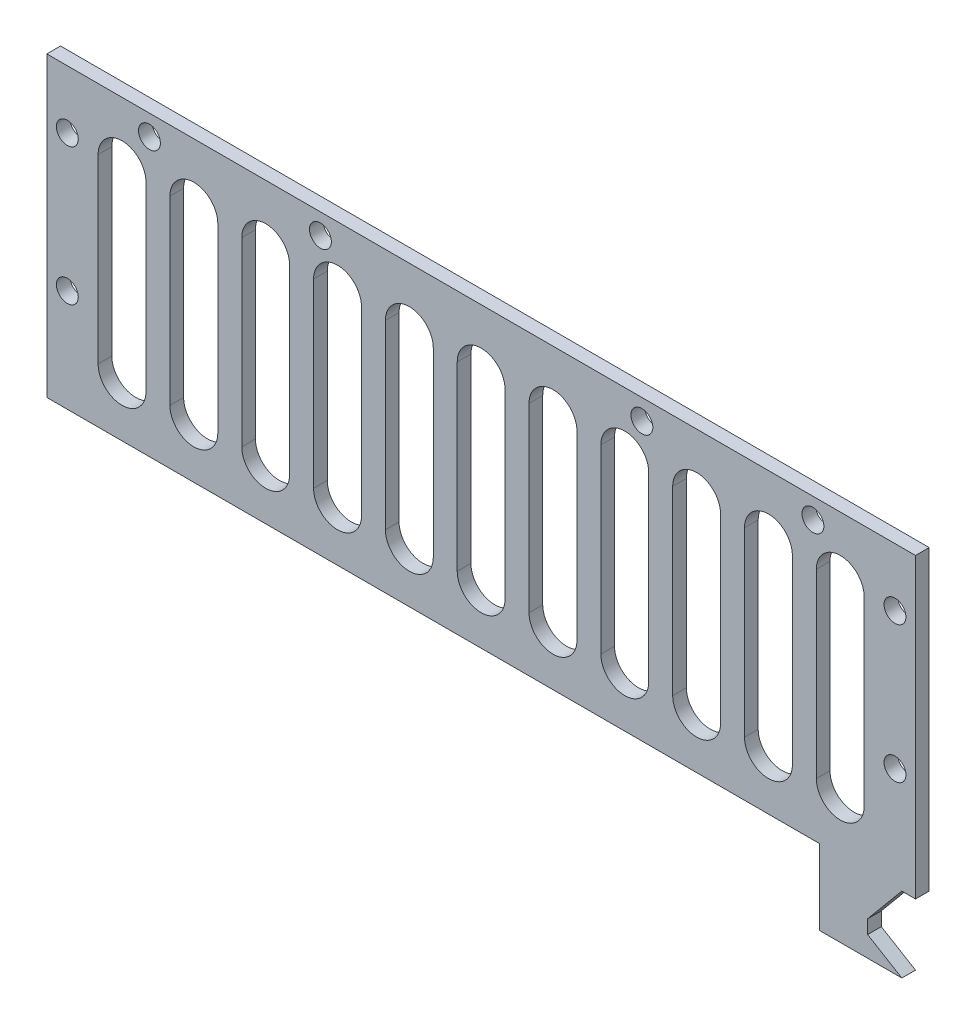
from build123d import *

# Parameters (mm, degrees)
SKETCH_1_W          = 6
SKETCH_1_H          = 40
SKETCH_1_R          = 1.6
EXTRUDE_1_DEPTH     = 2
CUT_EXTRUDE_1_DEPTH = 2
EXTRUDE_2_DEPTH     = 2


with BuildPart() as part:
    # 草图1 → 凸台-拉伸1 (new body)
    # profile 1 of 3: a face of its own
    with BuildSketch(Plane.XY):
        with Locations((-60.5, -1.75)):
            Rectangle(SKETCH_1_W, SKETCH_1_H)
        with Locations((-60.5, -6.75)):
            Circle(SKETCH_1_R, mode=Mode.SUBTRACT)
        with Locations((-60.5, 13.25)):
            Circle(SKETCH_1_R, mode=Mode.SUBTRACT)
    # profile 2 of 3: a face of its own
    with BuildSketch(Plane.XY):
        Polygon((-57.5, 18.25), (-57.5, -21.75), (57.5, -21.75), (57.5, 18.25), (63.5, 18.25), (63.5, 21.75), (-63.5, 21.75), (-63.5, 18.25), align=None)
        with Locations((-48.5, 18.75)):
            Circle(SKETCH_1_R, mode=Mode.SUBTRACT)
        with Locations((-23.5, 18.75)):
            Circle(SKETCH_1_R, mode=Mode.SUBTRACT)
        with Locations((23.5, 18.75)):
            Circle(SKETCH_1_R, mode=Mode.SUBTRACT)
        with Locations((48.5, 18.75)):
            Circle(SKETCH_1_R, mode=Mode.SUBTRACT)
    # profile 3 of 3: a face of its own
    with BuildSketch(Plane.XY):
        with Locations((60.5, -1.75)):
            Rectangle(SKETCH_1_W, SKETCH_1_H)
        with Locations((60.5, -6.75)):
            Circle(SKETCH_1_R, mode=Mode.SUBTRACT)
        with Locations((60.5, 13.25)):
            Circle(SKETCH_1_R, mode=Mode.SUBTRACT)
    extrude(amount=EXTRUDE_1_DEPTH)

    # 草图2 → 切除-拉伸1 (cut)
    with BuildSketch(Plane.XY.offset(2)):
        with BuildLine():
            Line((3.5, 12.75), (3.5, -13.75))
            ThreePointArc((3.5, -13.75), (0, -17.25), (-3.5, -13.75))
            Line((-3.5, -13.75), (-3.5, 12.75))
            ThreePointArc((-3.5, 12.75), (0, 16.25), (3.5, 12.75))
        make_face()
        with BuildLine():
            Line((14, 12.75), (14, -13.75))
            ThreePointArc((14, -13.75), (10.5, -17.25), (7, -13.75))
            Line((7, -13.75), (7, 12.75))
            ThreePointArc((7, 12.75), (10.5, 16.25), (14, 12.75))
        make_face()
        with BuildLine():
            Line((24.5, 12.75), (24.5, -13.75))
            ThreePointArc((24.5, -13.75), (21, -17.25), (17.5, -13.75))
            Line((17.5, -13.75), (17.5, 12.75))
            ThreePointArc((17.5, 12.75), (21, 16.25), (24.5, 12.75))
        make_face()
        with BuildLine():
            Line((35, 12.75), (35, -13.75))
            ThreePointArc((35, -13.75), (31.5, -17.25), (28, -13.75))
            Line((28, -13.75), (28, 12.75))
            ThreePointArc((28, 12.75), (31.5, 16.25), (35, 12.75))
        make_face()
        with BuildLine():
            Line((45.5, 12.75), (45.5, -13.75))
            ThreePointArc((45.5, -13.75), (42, -17.25), (38.5, -13.75))
            Line((38.5, -13.75), (38.5, 12.75))
            ThreePointArc((38.5, 12.75), (42, 16.25), (45.5, 12.75))
        make_face()
        with BuildLine():
            Line((-7, 12.75), (-7, -13.75))
            ThreePointArc((-7, -13.75), (-10.5, -17.25), (-14, -13.75))
            Line((-14, -13.75), (-14, 12.75))
            ThreePointArc((-14, 12.75), (-10.5, 16.25), (-7, 12.75))
        make_face()
        with BuildLine():
            Line((-17.5, 12.75), (-17.5, -13.75))
            ThreePointArc((-17.5, -13.75), (-21, -17.25), (-24.5, -13.75))
            Line((-24.5, -13.75), (-24.5, 12.75))
            ThreePointArc((-24.5, 12.75), (-21, 16.25), (-17.5, 12.75))
        make_face()
        with BuildLine():
            Line((-28, 12.75), (-28, -13.75))
            ThreePointArc((-28, -13.75), (-31.5, -17.25), (-35, -13.75))
            Line((-35, -13.75), (-35, 12.75))
            ThreePointArc((-35, 12.75), (-31.5, 16.25), (-28, 12.75))
        make_face()
        with BuildLine():
            Line((-38.5, 12.75), (-38.5, -13.75))
            ThreePointArc((-38.5, -13.75), (-42, -17.25), (-45.5, -13.75))
            Line((-45.5, -13.75), (-45.5, 12.75))
            ThreePointArc((-45.5, 12.75), (-42, 16.25), (-38.5, 12.75))
        make_face()
        with BuildLine():
            Line((-49, 12.75), (-49, -13.75))
            ThreePointArc((-49, -13.75), (-52.5, -17.25), (-56, -13.75))
            Line((-56, -13.75), (-56, 12.75))
            ThreePointArc((-56, 12.75), (-52.5, 16.25), (-49, 12.75))
        make_face()
        with BuildLine():
            Line((56, 12.75), (56, -13.75))
            ThreePointArc((56, -13.75), (52.5, -17.25), (49, -13.75))
            Line((49, -13.75), (49, 12.75))
            ThreePointArc((49, 12.75), (52.5, 16.25), (56, 12.75))
        make_face()
    extrude(amount=-CUT_EXTRUDE_1_DEPTH, mode=Mode.SUBTRACT)

    # 草图3 → 凸台-拉伸2 (add)
    with BuildSketch(Plane.XY.offset(2)):
        Polygon((49.5, -21.75), (49.5, -32.75), (61.5, -32.75), (56.5, -29.75), (56.5, -27.75), (61.5, -21.75), align=None)
    extrude(amount=-EXTRUDE_2_DEPTH)


solid = part.part
